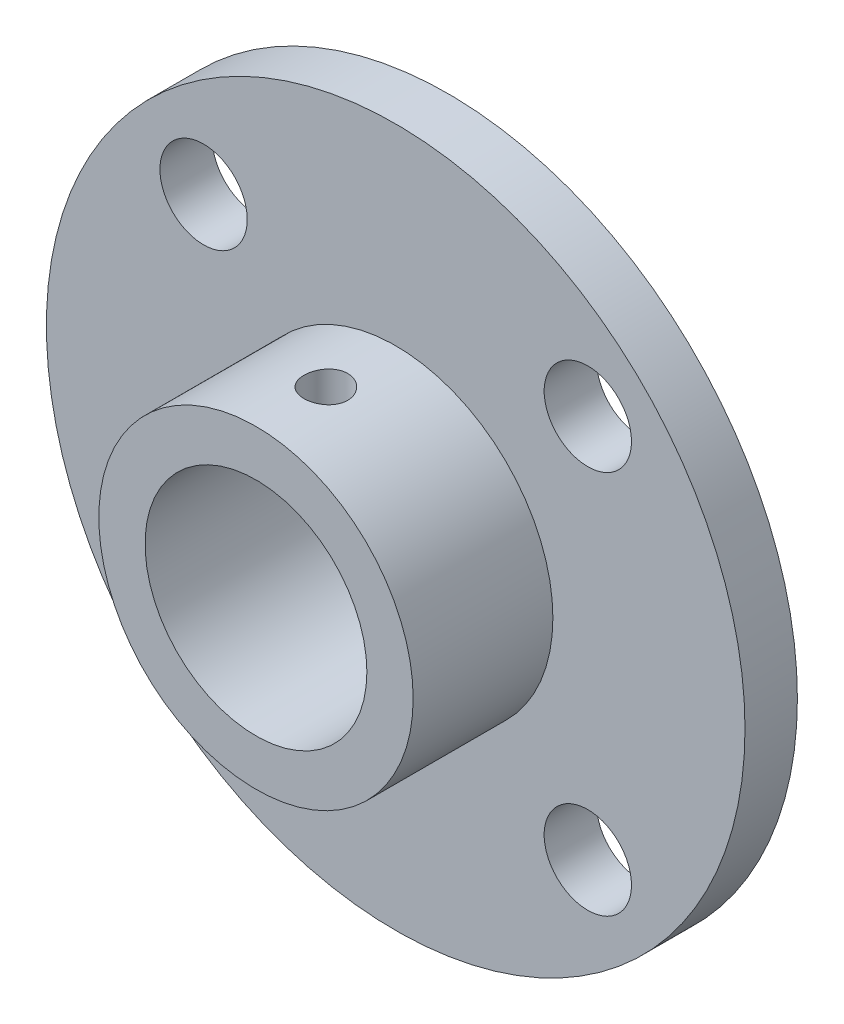
from build123d import *

# Parameters (mm, degrees)
SKETCH1_R                = 20
BOSS_EXTRUDE1_DEPTH      = 3
SKETCH2_R                = 9
BOSS_EXTRUDE2_DEPTH      = 8
SKETCH4_R                = 6.35
CUT_EXTRUDE1_DEPTH       = 31.347981811
M3_TAPPED_HOLE1_REACH    = 37.917
M3_TAPPED_HOLE1_BORE_R   = 1.25
F_5_0_5_DIAMETER_HOLE1_D = 5
CIRPATTERN1_COUNT        = 4


with BuildPart() as part:
    # Sketch1 → Boss-Extrude1 (new body)
    with BuildSketch(Plane.XY):
        Circle(SKETCH1_R)
    extrude(amount=BOSS_EXTRUDE1_DEPTH)

    # Sketch2 → Boss-Extrude2 (add)
    with BuildSketch(Plane.XY.offset(3)):
        Circle(SKETCH2_R)
    extrude(amount=BOSS_EXTRUDE2_DEPTH)

    # Sketch4 → Cut-Extrude1 (cut, through all)
    with BuildSketch(Plane.XY.offset(11)):
        Circle(SKETCH4_R)
    extrude(amount=-CUT_EXTRUDE1_DEPTH, mode=Mode.SUBTRACT)

    # M3 Tapped Hole1 bore (on position points) → M3 Tapped Hole1 (cut, up to next)
    with BuildSketch(Plane(origin=(0, 9, 7), x_dir=(1, 0, 0), z_dir=(0, 1, 0)), mode=Mode.PRIVATE) as m3_tapped_hole1_sk1:
        Circle(M3_TAPPED_HOLE1_BORE_R)
    m3_tapped_hole1_tool1 = extrude(m3_tapped_hole1_sk1.sketch, amount=-M3_TAPPED_HOLE1_REACH, mode=Mode.PRIVATE) & part.part
    add(m3_tapped_hole1_tool1.solids().sort_by_distance((0, 9, 7))[0], mode=Mode.SUBTRACT)

    # Ø5.0 (5) Diameter Hole1 (through all)
    with Locations(Plane(origin=(11, 11, 3), x_dir=(1, 0, 0), z_dir=(0, 0, 1))):
        with Locations((0, 0)):
            f_5_0_5_diameter_hole1 = Hole(F_5_0_5_DIAMETER_HOLE1_D / 2)

    # CirPattern1: Ø5.0 (5) Diameter Hole1 ×4 about axis
    cirpattern1_axis = Axis((0, 0, 0), (0, 0, 1))
    for i in range(1, CIRPATTERN1_COUNT):
        add(f_5_0_5_diameter_hole1.rotate(cirpattern1_axis, i * 360 / CIRPATTERN1_COUNT), mode=Mode.SUBTRACT)


solid = part.part
